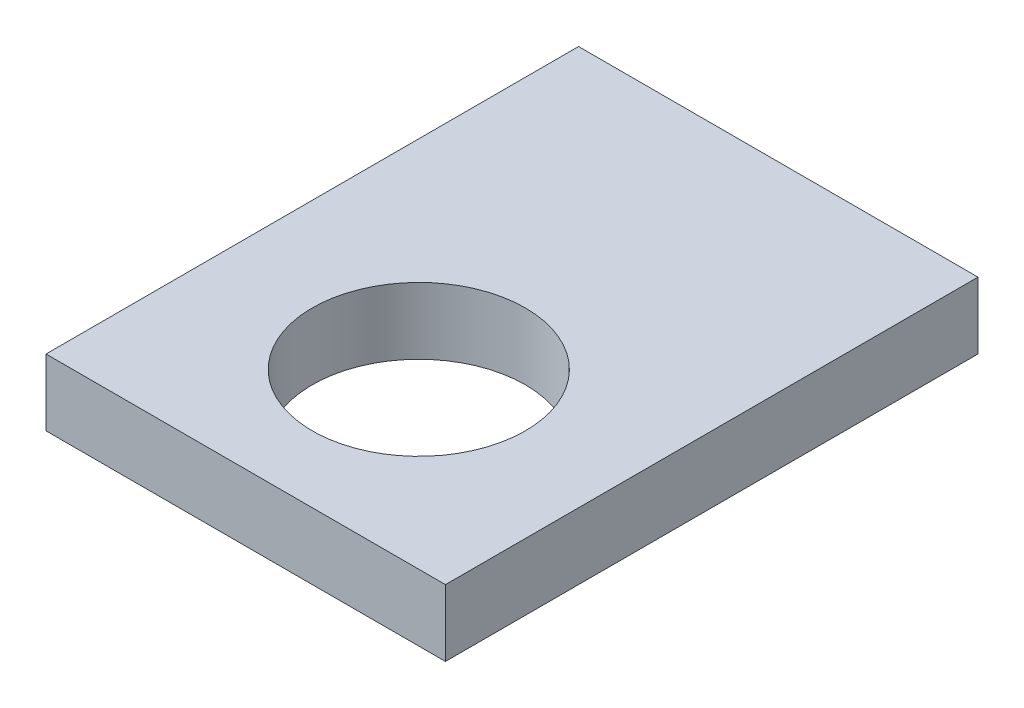
from build123d import *

# Parameters (mm, degrees)
ESQUISSE1_W             = 30
ESQUISSE1_H             = 5
BOSS_EXTRU_1_DEPTH      = 40
ESQUISSE2_R             = 8
ENL_V_MAT_EXTRU_1_DEPTH = 51.249378106


with BuildPart() as part:
    # Esquisse1 → Boss.-Extru.1 (new body)
    with BuildSketch(Plane.XY):
        with Locations((15, 2.5)):
            Rectangle(ESQUISSE1_W, ESQUISSE1_H)
    extrude(amount=BOSS_EXTRU_1_DEPTH)

    # Esquisse2 → Enlèv. mat.-Extru.1 (cut, through all)
    with BuildSketch(Plane.XZ):
        with Locations(Location((15, 27, 0), (0, 0, 270))):
            Circle(ESQUISSE2_R)
    extrude(amount=-ENL_V_MAT_EXTRU_1_DEPTH, mode=Mode.SUBTRACT)


solid = part.part
